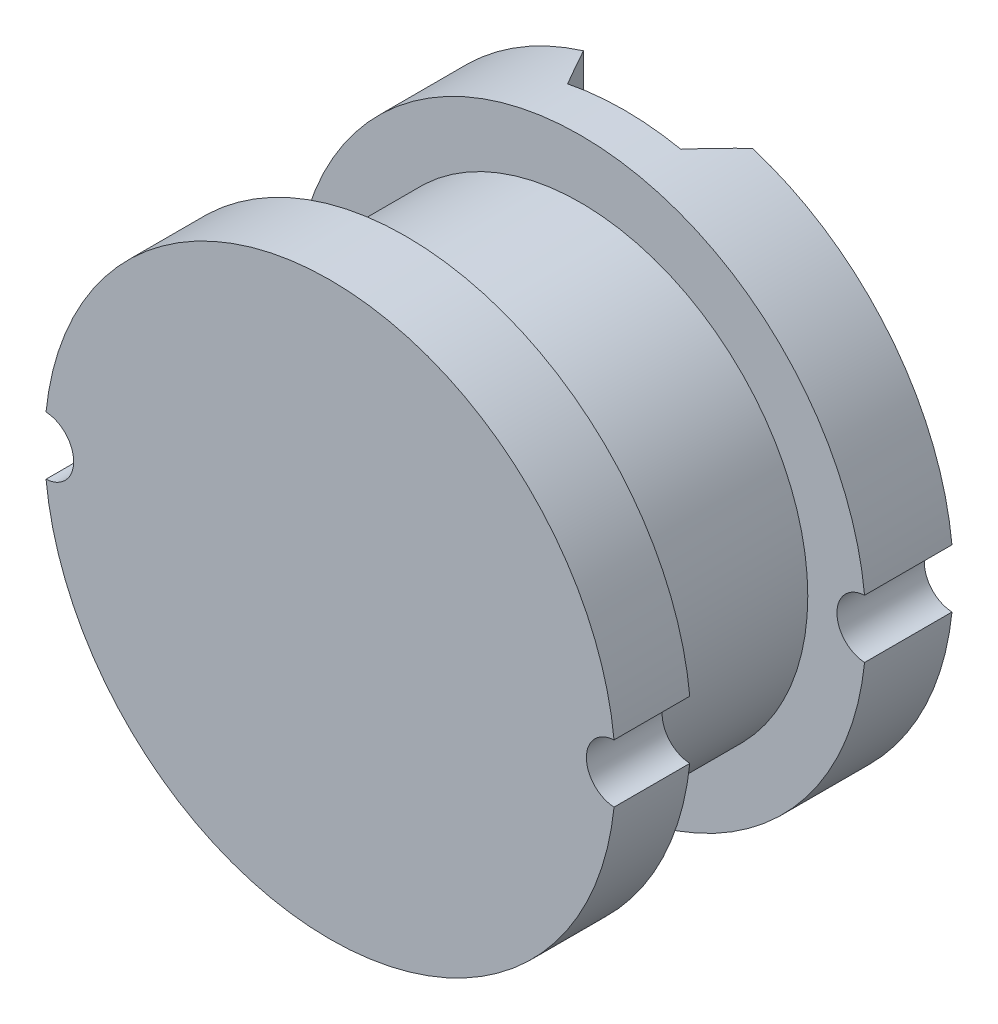
from build123d import *

# Parameters (mm, degrees)
SKETCH_1_R               = 4.9
EXTRUDE_1_DEPTH          = 1.5
SKETCH_3_R               = 3.9
EXTRUDE_2_DEPTH          = 3
SKETCH_4_R               = 4.9
EXTRUDE_3_DEPTH          = 1.3
CUT_EXTRUDE_1_DEPTH      = 10.036592278
CUT_EXTRUDE_1_DEPTH_BACK = 10.036592278
SKETCH_6_R               = 0.5
CUT_EXTRUDE_2_DEPTH      = 10.036592278


with BuildPart() as part:
    # Эскиз1 → Бобышка-Вытянуть1 (new body)
    with BuildSketch(Plane.XY):
        Circle(SKETCH_1_R)
    extrude(amount=EXTRUDE_1_DEPTH)

    # Эскиз3 → Бобышка-Вытянуть2 (add)
    with BuildSketch(Plane.XY.offset(1.5)):
        Circle(SKETCH_3_R)
    extrude(amount=EXTRUDE_2_DEPTH)

    # Эскиз4 → Бобышка-Вытянуть3 (add)
    with BuildSketch(Plane.XY.offset(4.5)):
        Circle(SKETCH_4_R)
    extrude(amount=EXTRUDE_3_DEPTH)

    # Эскиз5 → Вырез-Вытянуть1 (cut, two sides: drawn at the far end of the back side and taken through both)
    with BuildSketch(Plane(origin=(0, 0, 0), x_dir=(1, 0, 0), z_dir=(0, 1, 0)).offset(-CUT_EXTRUDE_1_DEPTH_BACK)):
        Polygon((1.45, 0), (0.971990262, -0.75), (-0.971990262, -0.75), (-1.45, 0), (-1.45, 0.521018793), (1.45, 0.521018793), align=None)
    extrude(amount=CUT_EXTRUDE_1_DEPTH + CUT_EXTRUDE_1_DEPTH_BACK, mode=Mode.SUBTRACT)

    # Эскиз6 → Вырез-Вытянуть2 (cut, through all)
    with BuildSketch(Plane.XY.offset(5.8)):
        with Locations((-4.9, 0)):
            Circle(SKETCH_6_R)
        with Locations((4.9, 0)):
            Circle(SKETCH_6_R)
    extrude(amount=-CUT_EXTRUDE_2_DEPTH, mode=Mode.SUBTRACT)


solid = part.part
